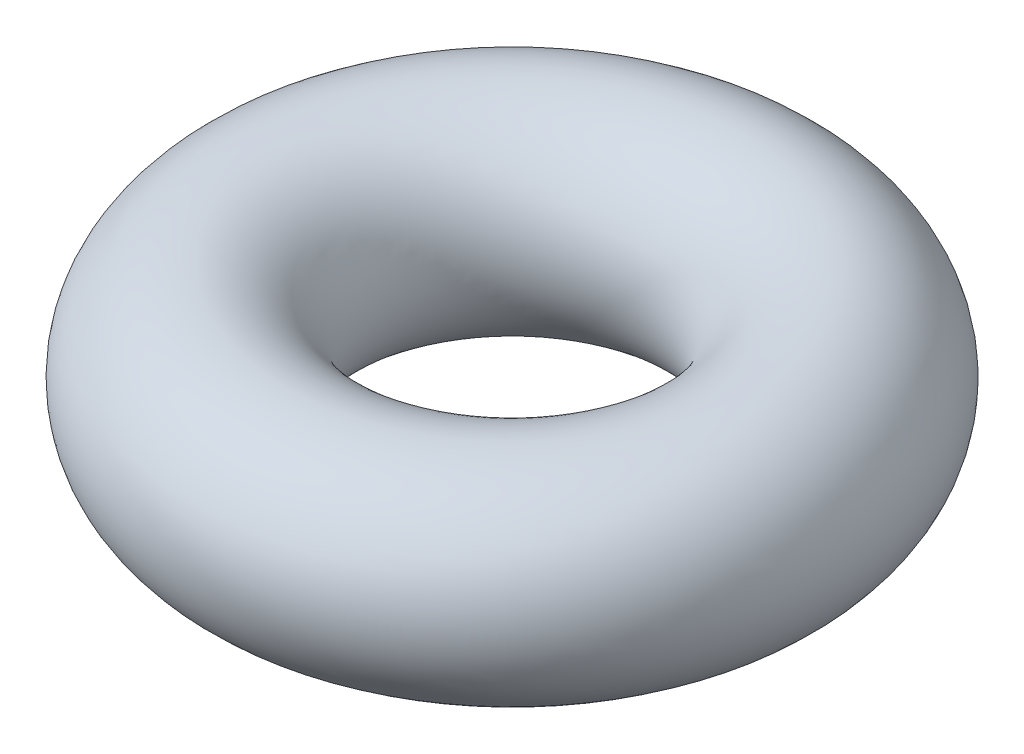
from build123d import *

# Parameters (mm, degrees)
SKETCH2_R = 0.9


with BuildPart() as part:
    # Sweep1: sweep along a path in Sketch1
    with BuildLine(Plane(origin=(0, 0, 0), x_dir=(1, 0, 0), z_dir=(0, 1, 0))) as sweep1_path:
        CenterArc((0, 0), 2, 0, 360)
    # Sketch2 → Sweep1 (sweep)
    with BuildSketch(Plane.XY):
        with Locations((-2, 0)):
            Circle(SKETCH2_R)
    sweep(path=sweep1_path.line)


solid = part.part
